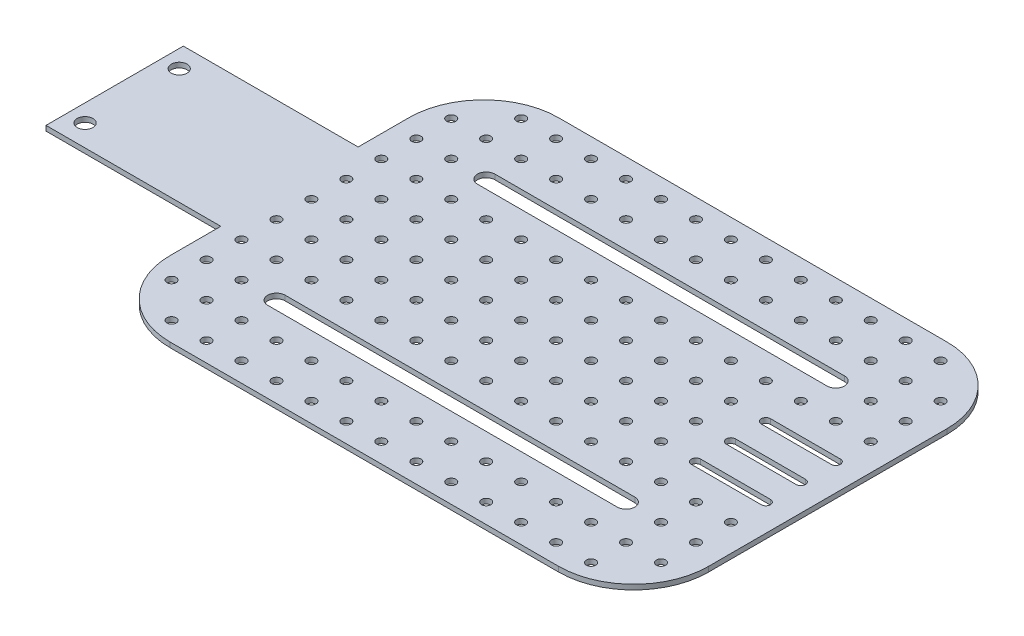
from build123d import *

# Parameters (mm, degrees)
SKETCH1_R           = 1.85
BOSS_EXTRUDE1_DEPTH = 2
SKETCH2_R           = 1.85
CUT_EXTRUDE1_DEPTH  = 2
SKETCH3_W           = 55
SKETCH3_H           = 2
CUT_EXTRUDE2_DEPTH  = 70
SKETCH4_R           = 3.15
CUT_EXTRUDE3_DEPTH  = 10
CUT_EXTRUDE4_DEPTH  = 10
SKETCH6_R           = 1.85
CUT_EXTRUDE5_DEPTH  = 237.263455966


with BuildPart() as part:
    # Sketch1 → Boss-Extrude1 (new body)
    with BuildSketch(Plane(origin=(0, 0, 0), x_dir=(1, 0, 0), z_dir=(0, 1, 0))):
        with BuildLine():
            Line((77.8, 155.575), (-77.8, 155.575))
            ThreePointArc((-77.8, 155.575), (-99.013203436, 146.788203436), (-107.8, 125.575))
            Line((-107.8, 125.575), (-107.8, 105.2875))
            Line((-107.8, 105.2875), (-177.8, 105.2875))
            Line((-177.8, 105.2875), (-177.8, 50.2875))
            Line((-177.8, 50.2875), (-107.8, 50.2875))
            Line((-107.8, 50.2875), (-107.8, 30))
            ThreePointArc((-107.8, 30), (-99.013203436, 8.786796564), (-77.8, 0))
            Line((-77.8, 0), (77.8, 0))
            ThreePointArc((77.8, 0), (99.013203436, 8.786796564), (107.8, 30))
            Line((107.8, 30), (107.8, 50.2875))
            Line((107.8, 50.2875), (177.8, 50.2875))
            Line((177.8, 50.2875), (177.8, 105.2875))
            Line((177.8, 105.2875), (107.8, 105.2875))
            Line((107.8, 105.2875), (107.8, 125.575))
            ThreePointArc((107.8, 125.575), (99.013203436, 146.788203436), (77.8, 155.575))
        make_face()
        with Locations(Location((173.4, 61.9875, 0), (0, 0, 90))):
            Circle(SKETCH1_R, mode=Mode.SUBTRACT)
        with Locations(Location((173.4, 93.5875, 0), (0, 0, 90))):
            Circle(SKETCH1_R, mode=Mode.SUBTRACT)
    extrude(amount=BOSS_EXTRUDE1_DEPTH)

    # Sketch2 → Cut-Extrude1 (cut)
    with BuildSketch(Plane(origin=(0, 2, 0), x_dir=(1, 0, 0), z_dir=(0, 1, 0))):
        with Locations(Location((-99.013203436, 21.7875, 0), (0, 0, 270))):
            Circle(SKETCH2_R)
        with Locations(Location((-99.013203436, 35.7875, 0), (0, 0, 270))):
            Circle(SKETCH2_R)
        with Locations(Location((-99.013203436, 49.7875, 0), (0, 0, 270))):
            Circle(SKETCH2_R)
        with Locations(Location((-99.013203436, 63.7875, 0), (0, 0, 270))):
            Circle(SKETCH2_R)
        with Locations(Location((-99.013203436, 77.7875, 0), (0, 0, 270))):
            Circle(SKETCH2_R)
        with Locations(Location((-99.013203436, 91.7875, 0), (0, 0, 270))):
            Circle(SKETCH2_R)
        with Locations(Location((-99.013203436, 105.7875, 0), (0, 0, 270))):
            Circle(SKETCH2_R)
        with Locations(Location((-99.013203436, 119.7875, 0), (0, 0, 270))):
            Circle(SKETCH2_R)
        with Locations(Location((-99.013203436, 133.7875, 0), (0, 0, 270))):
            Circle(SKETCH2_R)
        with Locations(Location((-85.013203436, 63.7875, 0), (0, 0, 270))):
            Circle(SKETCH2_R)
        with Locations(Location((-85.013203436, 49.7875, 0), (0, 0, 270))):
            Circle(SKETCH2_R)
        with Locations(Location((-85.013203436, 35.7875, 0), (0, 0, 270))):
            Circle(SKETCH2_R)
        with Locations(Location((-85.013203436, 21.7875, 0), (0, 0, 270))):
            Circle(SKETCH2_R)
        with Locations(Location((-85.013203436, 91.7875, 0), (0, 0, 270))):
            Circle(SKETCH2_R)
        with Locations(Location((-85.013203436, 105.7875, 0), (0, 0, 270))):
            Circle(SKETCH2_R)
        with Locations(Location((-85.013203436, 77.7875, 0), (0, 0, 270))):
            Circle(SKETCH2_R)
        with Locations(Location((-85.013203436, 133.7875, 0), (0, 0, 270))):
            Circle(SKETCH2_R)
        with Locations(Location((-85.013203436, 119.7875, 0), (0, 0, 270))):
            Circle(SKETCH2_R)
        with Locations(Location((-71.013203436, 63.7875, 0), (0, 0, 270))):
            Circle(SKETCH2_R)
        with Locations(Location((-71.013203436, 49.7875, 0), (0, 0, 270))):
            Circle(SKETCH2_R)
        with Locations(Location((-71.013203436, 35.7875, 0), (0, 0, 270))):
            Circle(SKETCH2_R)
        with Locations(Location((-71.013203436, 21.7875, 0), (0, 0, 270))):
            Circle(SKETCH2_R)
        with Locations(Location((-71.013203436, 91.7875, 0), (0, 0, 270))):
            Circle(SKETCH2_R)
        with Locations(Location((-71.013203436, 105.7875, 0), (0, 0, 270))):
            Circle(SKETCH2_R)
        with Locations(Location((-71.013203436, 77.7875, 0), (0, 0, 270))):
            Circle(SKETCH2_R)
        with Locations(Location((-71.013203436, 133.7875, 0), (0, 0, 270))):
            Circle(SKETCH2_R)
        with Locations(Location((-71.013203436, 119.7875, 0), (0, 0, 270))):
            Circle(SKETCH2_R)
        with Locations(Location((-57.013203436, 63.7875, 0), (0, 0, 270))):
            Circle(SKETCH2_R)
        with Locations(Location((-57.013203436, 49.7875, 0), (0, 0, 270))):
            Circle(SKETCH2_R)
        with Locations(Location((-57.013203436, 35.7875, 0), (0, 0, 270))):
            Circle(SKETCH2_R)
        with Locations(Location((-57.013203436, 21.7875, 0), (0, 0, 270))):
            Circle(SKETCH2_R)
        with Locations(Location((-57.013203436, 91.7875, 0), (0, 0, 270))):
            Circle(SKETCH2_R)
        with Locations(Location((-57.013203436, 105.7875, 0), (0, 0, 270))):
            Circle(SKETCH2_R)
        with Locations(Location((-57.013203436, 77.7875, 0), (0, 0, 270))):
            Circle(SKETCH2_R)
        with Locations(Location((-57.013203436, 133.7875, 0), (0, 0, 270))):
            Circle(SKETCH2_R)
        with Locations(Location((-57.013203436, 119.7875, 0), (0, 0, 270))):
            Circle(SKETCH2_R)
        with Locations(Location((-43.013203436, 63.7875, 0), (0, 0, 270))):
            Circle(SKETCH2_R)
        with Locations(Location((-43.013203436, 49.7875, 0), (0, 0, 270))):
            Circle(SKETCH2_R)
        with Locations(Location((-43.013203436, 35.7875, 0), (0, 0, 270))):
            Circle(SKETCH2_R)
        with Locations(Location((-43.013203436, 21.7875, 0), (0, 0, 270))):
            Circle(SKETCH2_R)
        with Locations(Location((-43.013203436, 91.7875, 0), (0, 0, 270))):
            Circle(SKETCH2_R)
        with Locations(Location((-43.013203436, 105.7875, 0), (0, 0, 270))):
            Circle(SKETCH2_R)
        with Locations(Location((-43.013203436, 77.7875, 0), (0, 0, 270))):
            Circle(SKETCH2_R)
        with Locations(Location((-43.013203436, 133.7875, 0), (0, 0, 270))):
            Circle(SKETCH2_R)
        with Locations(Location((-43.013203436, 119.7875, 0), (0, 0, 270))):
            Circle(SKETCH2_R)
        with Locations(Location((-29.013203436, 63.7875, 0), (0, 0, 270))):
            Circle(SKETCH2_R)
        with Locations(Location((-29.013203436, 49.7875, 0), (0, 0, 270))):
            Circle(SKETCH2_R)
        with Locations(Location((-29.013203436, 35.7875, 0), (0, 0, 270))):
            Circle(SKETCH2_R)
        with Locations(Location((-29.013203436, 21.7875, 0), (0, 0, 270))):
            Circle(SKETCH2_R)
        with Locations(Location((-29.013203436, 91.7875, 0), (0, 0, 270))):
            Circle(SKETCH2_R)
        with Locations(Location((-29.013203436, 105.7875, 0), (0, 0, 270))):
            Circle(SKETCH2_R)
        with Locations(Location((-29.013203436, 77.7875, 0), (0, 0, 270))):
            Circle(SKETCH2_R)
        with Locations(Location((-29.013203436, 133.7875, 0), (0, 0, 270))):
            Circle(SKETCH2_R)
        with Locations(Location((-29.013203436, 119.7875, 0), (0, 0, 270))):
            Circle(SKETCH2_R)
        with Locations(Location((-15.013203436, 63.7875, 0), (0, 0, 270))):
            Circle(SKETCH2_R)
        with Locations(Location((-15.013203436, 49.7875, 0), (0, 0, 270))):
            Circle(SKETCH2_R)
        with Locations(Location((-15.013203436, 35.7875, 0), (0, 0, 270))):
            Circle(SKETCH2_R)
        with Locations(Location((-15.013203436, 21.7875, 0), (0, 0, 270))):
            Circle(SKETCH2_R)
        with Locations(Location((-15.013203436, 91.7875, 0), (0, 0, 270))):
            Circle(SKETCH2_R)
        with Locations(Location((-15.013203436, 105.7875, 0), (0, 0, 270))):
            Circle(SKETCH2_R)
        with Locations(Location((-15.013203436, 77.7875, 0), (0, 0, 270))):
            Circle(SKETCH2_R)
        with Locations(Location((-15.013203436, 133.7875, 0), (0, 0, 270))):
            Circle(SKETCH2_R)
        with Locations(Location((-15.013203436, 119.7875, 0), (0, 0, 270))):
            Circle(SKETCH2_R)
        with Locations(Location((-1.013203436, 63.7875, 0), (0, 0, 270))):
            Circle(SKETCH2_R)
        with Locations(Location((-1.013203436, 49.7875, 0), (0, 0, 270))):
            Circle(SKETCH2_R)
        with Locations(Location((-1.013203436, 35.7875, 0), (0, 0, 270))):
            Circle(SKETCH2_R)
        with Locations(Location((-1.013203436, 21.7875, 0), (0, 0, 270))):
            Circle(SKETCH2_R)
        with Locations(Location((-1.013203436, 91.7875, 0), (0, 0, 270))):
            Circle(SKETCH2_R)
        with Locations(Location((-1.013203436, 105.7875, 0), (0, 0, 270))):
            Circle(SKETCH2_R)
        with Locations(Location((-1.013203436, 77.7875, 0), (0, 0, 270))):
            Circle(SKETCH2_R)
        with Locations(Location((-1.013203436, 133.7875, 0), (0, 0, 270))):
            Circle(SKETCH2_R)
        with Locations(Location((-1.013203436, 119.7875, 0), (0, 0, 270))):
            Circle(SKETCH2_R)
        with Locations(Location((12.986796564, 63.7875, 0), (0, 0, 270))):
            Circle(SKETCH2_R)
        with Locations(Location((12.986796564, 49.7875, 0), (0, 0, 270))):
            Circle(SKETCH2_R)
        with Locations(Location((12.986796564, 35.7875, 0), (0, 0, 270))):
            Circle(SKETCH2_R)
        with Locations(Location((12.986796564, 21.7875, 0), (0, 0, 270))):
            Circle(SKETCH2_R)
        with Locations(Location((12.986796564, 91.7875, 0), (0, 0, 270))):
            Circle(SKETCH2_R)
        with Locations(Location((12.986796564, 105.7875, 0), (0, 0, 270))):
            Circle(SKETCH2_R)
        with Locations(Location((12.986796564, 77.7875, 0), (0, 0, 270))):
            Circle(SKETCH2_R)
        with Locations(Location((12.986796564, 133.7875, 0), (0, 0, 270))):
            Circle(SKETCH2_R)
        with Locations(Location((12.986796564, 119.7875, 0), (0, 0, 270))):
            Circle(SKETCH2_R)
        with Locations(Location((26.986796564, 63.7875, 0), (0, 0, 270))):
            Circle(SKETCH2_R)
        with Locations(Location((26.986796564, 49.7875, 0), (0, 0, 270))):
            Circle(SKETCH2_R)
        with Locations(Location((26.986796564, 35.7875, 0), (0, 0, 270))):
            Circle(SKETCH2_R)
        with Locations(Location((26.986796564, 21.7875, 0), (0, 0, 270))):
            Circle(SKETCH2_R)
        with Locations(Location((26.986796564, 91.7875, 0), (0, 0, 270))):
            Circle(SKETCH2_R)
        with Locations(Location((26.986796564, 105.7875, 0), (0, 0, 270))):
            Circle(SKETCH2_R)
        with Locations(Location((26.986796564, 77.7875, 0), (0, 0, 270))):
            Circle(SKETCH2_R)
        with Locations(Location((26.986796564, 133.7875, 0), (0, 0, 270))):
            Circle(SKETCH2_R)
        with Locations(Location((26.986796564, 119.7875, 0), (0, 0, 270))):
            Circle(SKETCH2_R)
        with Locations(Location((40.986796564, 63.7875, 0), (0, 0, 270))):
            Circle(SKETCH2_R)
        with Locations(Location((40.986796564, 49.7875, 0), (0, 0, 270))):
            Circle(SKETCH2_R)
        with Locations(Location((40.986796564, 35.7875, 0), (0, 0, 270))):
            Circle(SKETCH2_R)
        with Locations(Location((40.986796564, 21.7875, 0), (0, 0, 270))):
            Circle(SKETCH2_R)
        with Locations(Location((40.986796564, 91.7875, 0), (0, 0, 270))):
            Circle(SKETCH2_R)
        with Locations(Location((40.986796564, 105.7875, 0), (0, 0, 270))):
            Circle(SKETCH2_R)
        with Locations(Location((40.986796564, 77.7875, 0), (0, 0, 270))):
            Circle(SKETCH2_R)
        with Locations(Location((40.986796564, 133.7875, 0), (0, 0, 270))):
            Circle(SKETCH2_R)
        with Locations(Location((40.986796564, 119.7875, 0), (0, 0, 270))):
            Circle(SKETCH2_R)
        with Locations(Location((54.986796564, 63.7875, 0), (0, 0, 270))):
            Circle(SKETCH2_R)
        with Locations(Location((54.986796564, 49.7875, 0), (0, 0, 270))):
            Circle(SKETCH2_R)
        with Locations(Location((54.986796564, 35.7875, 0), (0, 0, 270))):
            Circle(SKETCH2_R)
        with Locations(Location((54.986796564, 21.7875, 0), (0, 0, 270))):
            Circle(SKETCH2_R)
        with Locations(Location((54.986796564, 91.7875, 0), (0, 0, 270))):
            Circle(SKETCH2_R)
        with Locations(Location((54.986796564, 105.7875, 0), (0, 0, 270))):
            Circle(SKETCH2_R)
        with Locations(Location((54.986796564, 77.7875, 0), (0, 0, 270))):
            Circle(SKETCH2_R)
        with Locations(Location((54.986796564, 133.7875, 0), (0, 0, 270))):
            Circle(SKETCH2_R)
        with Locations(Location((54.986796564, 119.7875, 0), (0, 0, 270))):
            Circle(SKETCH2_R)
        with Locations(Location((68.986796564, 63.7875, 0), (0, 0, 270))):
            Circle(SKETCH2_R)
        with Locations(Location((68.986796564, 49.7875, 0), (0, 0, 270))):
            Circle(SKETCH2_R)
        with Locations(Location((68.986796564, 35.7875, 0), (0, 0, 270))):
            Circle(SKETCH2_R)
        with Locations(Location((68.986796564, 21.7875, 0), (0, 0, 270))):
            Circle(SKETCH2_R)
        with Locations(Location((68.986796564, 91.7875, 0), (0, 0, 270))):
            Circle(SKETCH2_R)
        with Locations(Location((68.986796564, 105.7875, 0), (0, 0, 270))):
            Circle(SKETCH2_R)
        with Locations(Location((68.986796564, 77.7875, 0), (0, 0, 270))):
            Circle(SKETCH2_R)
        with Locations(Location((68.986796564, 133.7875, 0), (0, 0, 270))):
            Circle(SKETCH2_R)
        with Locations(Location((68.986796564, 119.7875, 0), (0, 0, 270))):
            Circle(SKETCH2_R)
        with Locations(Location((82.986796564, 63.7875, 0), (0, 0, 270))):
            Circle(SKETCH2_R)
        with Locations(Location((82.986796564, 49.7875, 0), (0, 0, 270))):
            Circle(SKETCH2_R)
        with Locations(Location((82.986796564, 35.7875, 0), (0, 0, 270))):
            Circle(SKETCH2_R)
        with Locations(Location((82.986796564, 21.7875, 0), (0, 0, 270))):
            Circle(SKETCH2_R)
        with Locations(Location((82.986796564, 91.7875, 0), (0, 0, 270))):
            Circle(SKETCH2_R)
        with Locations(Location((82.986796564, 105.7875, 0), (0, 0, 270))):
            Circle(SKETCH2_R)
        with Locations(Location((82.986796564, 77.7875, 0), (0, 0, 270))):
            Circle(SKETCH2_R)
        with Locations(Location((82.986796564, 133.7875, 0), (0, 0, 270))):
            Circle(SKETCH2_R)
        with Locations(Location((82.986796564, 119.7875, 0), (0, 0, 270))):
            Circle(SKETCH2_R)
        with Locations(Location((96.986796564, 63.7875, 0), (0, 0, 270))):
            Circle(SKETCH2_R)
        with Locations(Location((96.986796564, 49.7875, 0), (0, 0, 270))):
            Circle(SKETCH2_R)
        with Locations(Location((96.986796564, 35.7875, 0), (0, 0, 270))):
            Circle(SKETCH2_R)
        with Locations(Location((96.986796564, 21.7875, 0), (0, 0, 270))):
            Circle(SKETCH2_R)
        with Locations(Location((96.986796564, 91.7875, 0), (0, 0, 270))):
            Circle(SKETCH2_R)
        with Locations(Location((96.986796564, 105.7875, 0), (0, 0, 270))):
            Circle(SKETCH2_R)
        with Locations(Location((96.986796564, 77.7875, 0), (0, 0, 270))):
            Circle(SKETCH2_R)
        with Locations(Location((96.986796564, 133.7875, 0), (0, 0, 270))):
            Circle(SKETCH2_R)
        with Locations(Location((96.986796564, 119.7875, 0), (0, 0, 270))):
            Circle(SKETCH2_R)
        with Locations(Location((-85.013203436, 147.7875, 0), (0, 0, 270))):
            Circle(SKETCH2_R)
        with Locations(Location((-1.013203436, 147.7875, 0), (0, 0, 270))):
            Circle(SKETCH2_R)
        with Locations(Location((-15.013203436, 147.7875, 0), (0, 0, 270))):
            Circle(SKETCH2_R)
        with Locations(Location((-29.013203436, 147.7875, 0), (0, 0, 270))):
            Circle(SKETCH2_R)
        with Locations(Location((-43.013203436, 147.7875, 0), (0, 0, 270))):
            Circle(SKETCH2_R)
        with Locations(Location((-57.013203436, 147.7875, 0), (0, 0, 270))):
            Circle(SKETCH2_R)
        with Locations(Location((-71.013203436, 147.7875, 0), (0, 0, 270))):
            Circle(SKETCH2_R)
        with Locations(Location((12.986796564, 147.7875, 0), (0, 0, 270))):
            Circle(SKETCH2_R)
        with Locations(Location((26.986796564, 147.7875, 0), (0, 0, 270))):
            Circle(SKETCH2_R)
        with Locations(Location((82.986796564, 147.7875, 0), (0, 0, 270))):
            Circle(SKETCH2_R)
        with Locations(Location((68.986796564, 147.7875, 0), (0, 0, 270))):
            Circle(SKETCH2_R)
        with Locations(Location((54.986796564, 147.7875, 0), (0, 0, 270))):
            Circle(SKETCH2_R)
        with Locations(Location((40.986796564, 147.7875, 0), (0, 0, 270))):
            Circle(SKETCH2_R)
        with Locations(Location((-85.013203436, 7.7875, 0), (0, 0, 270))):
            Circle(SKETCH2_R)
        with Locations(Location((-71.013203436, 7.7875, 0), (0, 0, 270))):
            Circle(SKETCH2_R)
        with Locations(Location((-57.013203436, 7.7875, 0), (0, 0, 270))):
            Circle(SKETCH2_R)
        with Locations(Location((-43.013203436, 7.7875, 0), (0, 0, 270))):
            Circle(SKETCH2_R)
        with Locations(Location((-29.013203436, 7.7875, 0), (0, 0, 270))):
            Circle(SKETCH2_R)
        with Locations(Location((-15.013203436, 7.7875, 0), (0, 0, 270))):
            Circle(SKETCH2_R)
        with Locations(Location((-1.013203436, 7.7875, 0), (0, 0, 270))):
            Circle(SKETCH2_R)
        with Locations(Location((12.986796564, 7.7875, 0), (0, 0, 270))):
            Circle(SKETCH2_R)
        with Locations(Location((26.986796564, 7.7875, 0), (0, 0, 270))):
            Circle(SKETCH2_R)
        with Locations(Location((40.986796564, 7.7875, 0), (0, 0, 270))):
            Circle(SKETCH2_R)
        with Locations(Location((54.986796564, 7.7875, 0), (0, 0, 270))):
            Circle(SKETCH2_R)
        with Locations(Location((68.986796564, 7.7875, 0), (0, 0, 270))):
            Circle(SKETCH2_R)
        with Locations(Location((82.986796564, 7.7875, 0), (0, 0, 270))):
            Circle(SKETCH2_R)
    extrude(amount=-CUT_EXTRUDE1_DEPTH, mode=Mode.SUBTRACT)

    # Sketch3 → Cut-Extrude2 (cut)
    with BuildSketch(Plane(origin=(177.8, 0, 0), x_dir=(0, 0, -1), z_dir=(1, 0, 0))):
        with Locations((77.7875, 1)):
            Rectangle(SKETCH3_W, SKETCH3_H)
    extrude(amount=-CUT_EXTRUDE2_DEPTH, mode=Mode.SUBTRACT)

    # Sketch4 → Cut-Extrude3 (cut)
    with BuildSketch(Plane(origin=(0, 2, 0), x_dir=(1, 0, 0), z_dir=(0, 1, 0))):
        with Locations(Location((-170.8, 96.6375, 0), (0, 0, 270))):
            Circle(SKETCH4_R)
        with Locations(Location((-170.8, 58.9375, 0), (0, 0, 270))):
            Circle(SKETCH4_R)
    extrude(amount=-CUT_EXTRUDE3_DEPTH, mode=Mode.SUBTRACT)

    # Sketch5 → Cut-Extrude4 (cut)
    with BuildSketch(Plane(origin=(0, 2, 0), x_dir=(1, 0, 0), z_dir=(0, 1, 0))):
        with BuildLine():
            Line((-71.013203436, 123.2875), (68.986796564, 123.2875))
            ThreePointArc((68.986796564, 123.2875), (72.486796564, 119.7875), (68.986796564, 116.2875))
            Line((68.986796564, 116.2875), (-71.013203436, 116.2875))
            ThreePointArc((-71.013203436, 116.2875), (-74.513203436, 119.7875), (-71.013203436, 123.2875))
        make_face()
        with BuildLine():
            Line((-71.013203436, 39.2875), (68.986796564, 39.2875))
            ThreePointArc((68.986796564, 39.2875), (72.486796564, 35.7875), (68.986796564, 32.2875))
            Line((68.986796564, 32.2875), (-71.013203436, 32.2875))
            ThreePointArc((-71.013203436, 32.2875), (-74.513203436, 35.7875), (-71.013203436, 39.2875))
        make_face()
    extrude(amount=-CUT_EXTRUDE4_DEPTH, mode=Mode.SUBTRACT)

    # Sketch6 → Cut-Extrude5 (cut, through all)
    # profile 1 of 6: a face of its own
    with BuildSketch(Plane(origin=(0, 2, 0), x_dir=(1, 0, 0), z_dir=(0, 1, 0))):
        with Locations((96.986796564, 63.7875)):
            Circle(SKETCH6_R)
    # profile 2 of 6: a face of its own
    with BuildSketch(Plane(origin=(0, 2, 0), x_dir=(1, 0, 0), z_dir=(0, 1, 0))):
        with Locations((96.986796564, 77.7875)):
            Circle(SKETCH6_R)
    # profile 3 of 6: a face of its own
    with BuildSketch(Plane(origin=(0, 2, 0), x_dir=(1, 0, 0), z_dir=(0, 1, 0))):
        with Locations((96.986796564, 91.7875)):
            Circle(SKETCH6_R)
    # profile 4 of 6: a face of its own
    with BuildSketch(Plane(origin=(0, 2, 0), x_dir=(1, 0, 0), z_dir=(0, 1, 0))):
        with BuildLine():
            Line((68.986796564, 93.6375), (96.986796564, 93.6375))
            ThreePointArc((96.986796564, 93.6375), (98.836796564, 91.7875), (96.986796564, 89.9375))
            Line((96.986796564, 89.9375), (68.986796564, 89.9375))
            ThreePointArc((68.986796564, 89.9375), (67.136796564, 91.7875), (68.986796564, 93.6375))
        make_face()
        with Locations((68.986796564, 91.7875)):
            Circle(SKETCH6_R, mode=Mode.SUBTRACT)
        with Locations((82.986796564, 91.7875)):
            Circle(SKETCH6_R, mode=Mode.SUBTRACT)
    # profile 5 of 6: a face of its own
    with BuildSketch(Plane(origin=(0, 2, 0), x_dir=(1, 0, 0), z_dir=(0, 1, 0))):
        with BuildLine():
            Line((68.986796564, 79.6375), (96.986796564, 79.6375))
            ThreePointArc((96.986796564, 79.6375), (98.836796564, 77.7875), (96.986796564, 75.9375))
            Line((96.986796564, 75.9375), (68.986796564, 75.9375))
            ThreePointArc((68.986796564, 75.9375), (67.136796564, 77.7875), (68.986796564, 79.6375))
        make_face()
        with Locations((82.986796564, 77.7875)):
            Circle(SKETCH6_R, mode=Mode.SUBTRACT)
        with Locations((68.986796564, 77.7875)):
            Circle(SKETCH6_R, mode=Mode.SUBTRACT)
    # profile 6 of 6: a face of its own
    with BuildSketch(Plane(origin=(0, 2, 0), x_dir=(1, 0, 0), z_dir=(0, 1, 0))):
        with BuildLine():
            Line((96.986796564, 61.9375), (68.986796564, 61.9375))
            ThreePointArc((68.986796564, 61.9375), (67.136796564, 63.7875), (68.986796564, 65.6375))
            Line((68.986796564, 65.6375), (96.986796564, 65.6375))
            ThreePointArc((96.986796564, 65.6375), (98.836796564, 63.7875), (96.986796564, 61.9375))
        make_face()
        with Locations((82.986796564, 63.7875)):
            Circle(SKETCH6_R, mode=Mode.SUBTRACT)
        with Locations((68.986796564, 63.7875)):
            Circle(SKETCH6_R, mode=Mode.SUBTRACT)
    extrude(amount=-CUT_EXTRUDE5_DEPTH, mode=Mode.SUBTRACT)


solid = part.part
